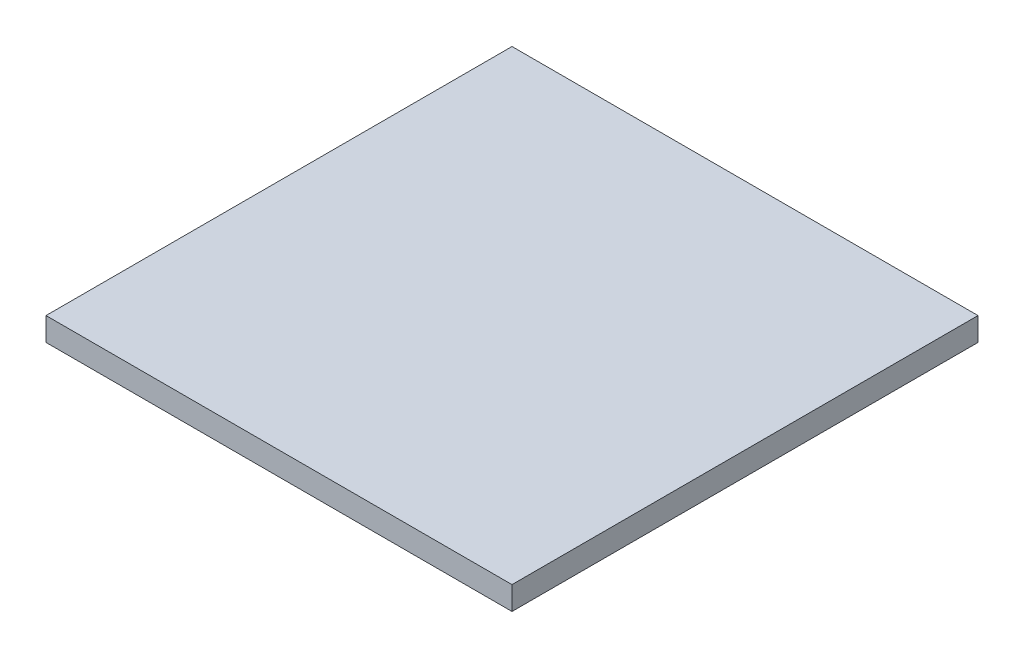
from build123d import *

# Parameters (mm, degrees)
SKTABLAMOVILPLATAFORMA_W   = 500
SKTABLAMOVILPLATAFORMA_H   = 500
TABLAMOVILPLATAFORMA_DEPTH = 25


with BuildPart() as part:
    # SkTablaMovilPlataforma → TablaMovilPlataforma (new body)
    with BuildSketch(Plane(origin=(0, 0, 0), x_dir=(1, 0, 0), z_dir=(0, 1, 0))):
        Rectangle(SKTABLAMOVILPLATAFORMA_W, SKTABLAMOVILPLATAFORMA_H)
    extrude(amount=TABLAMOVILPLATAFORMA_DEPTH)


solid = part.part
